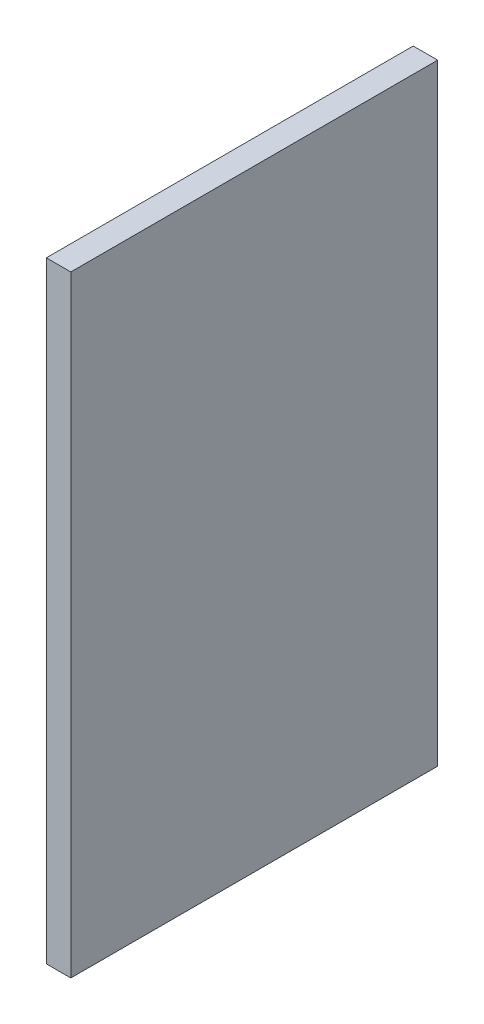
from build123d import *

# Parameters (mm, degrees)
MATING_PATCH_20X12X0P8_DEPTH      = 10
MATING_PATCH_20X12X0P8_DEPTH_BACK = 10
SKETCH_1_W                        = 0.8
SKETCH_1_H                        = 12


with BuildPart() as part:
    # 草图1 → Mating_patch_20x12x0p8 (new, two sides: drawn at the far end of the back side and taken through both)
    with BuildSketch(Plane(origin=(0, 0, 0), x_dir=(1, 0, 0), z_dir=(0, 1, 0)).offset(-MATING_PATCH_20X12X0P8_DEPTH_BACK)):
        with Locations((-110.4, -32)):
            Rectangle(SKETCH_1_W, SKETCH_1_H)
    extrude(amount=MATING_PATCH_20X12X0P8_DEPTH + MATING_PATCH_20X12X0P8_DEPTH_BACK)


solid = part.part
